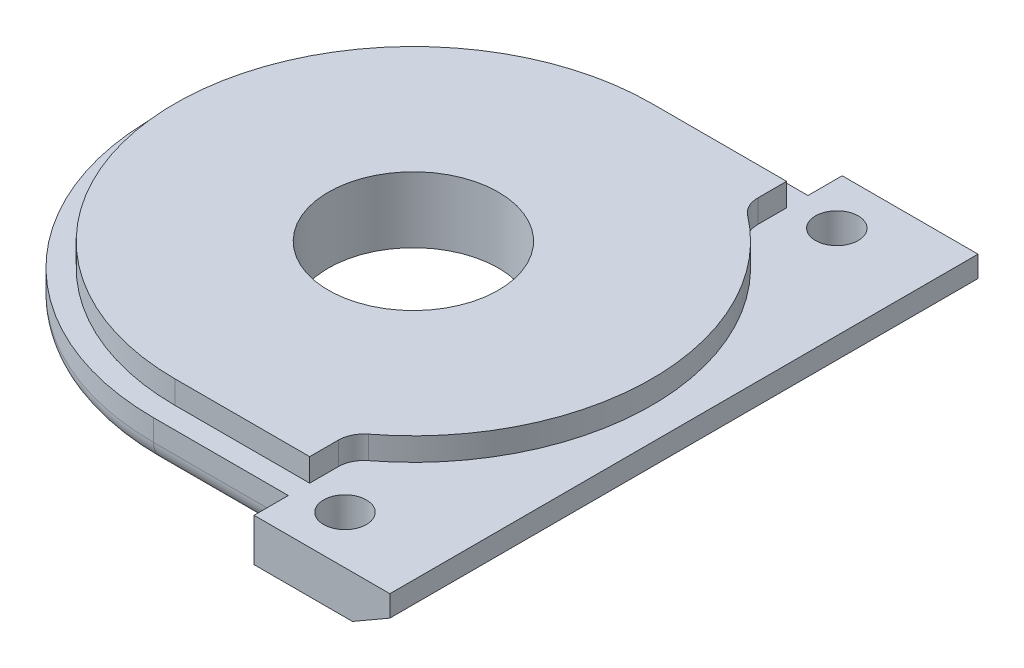
from build123d import *

# Parameters (mm, degrees)
BOSS_EXTRUDE1_DEPTH = 4
BOSS_EXTRUDE2_DEPTH = 2.25
SKETCH3_R           = 7.95
CUT_EXTRUDE1_DEPTH  = 9.25
SKETCH4_R           = 2
CUT_EXTRUDE2_DEPTH  = 9.25
CUT_EXTRUDE3_DEPTH  = 3
FILLET1_R           = 2.36
CHAMFER1_SIZE       = 3.5
CHAMFER1_SIZE2      = 2.020725942
BOSS_EXTRUDE3_DEPTH = 4
FILLET2_R           = 2
SKETCH7_W           = 56.562445917
SKETCH7_H           = 51.963873078
CUT_EXTRUDE4_DEPTH  = 0.1
FILLET3_R           = 2.38


with BuildPart() as part:
    # Sketch1 → Boss-Extrude1 (new body)
    with BuildSketch(Plane(origin=(0, 0, 0), x_dir=(1, 0, 0), z_dir=(0, 1, 0))):
        with BuildLine():
            Line((-13.29118379, 20.889836125), (-0.68999579, 20.889836125))
            Line((-0.68999579, 20.889836125), (-0.68999579, 24.09210312))
            Line((-0.68999579, 24.09210312), (-0.68999579, 26.09210312))
            Line((-0.68999579, 26.09210312), (12.01000421, 26.09210312))
            Line((12.01000421, 26.09210312), (12.01000421, 24.09210312))
            Line((12.01000421, 24.09210312), (12.01000421, -26.90789688))
            Line((12.01000421, -26.90789688), (12.01000421, -28.90789688))
            Line((12.01000421, -28.90789688), (-0.68999579, -28.90789688))
            Line((-0.68999579, -28.90789688), (-0.68999579, -26.90789688))
            Line((-0.68999579, -26.90789688), (-0.68999579, -23.705629885))
            Line((-0.68999579, -23.705629885), (-13.29118379, -23.705629885))
            ThreePointArc((-13.29118379, -23.705629885), (-35.588916795, -1.40789688), (-13.29118379, 20.889836125))
        make_face()
    extrude(amount=BOSS_EXTRUDE1_DEPTH)

    # Sketch2 → Boss-Extrude2 (add)
    with BuildSketch(Plane(origin=(0, 4, 0), x_dir=(1, 0, 0), z_dir=(0, 1, 0))):
        with BuildLine():
            Line((-0.68999579, 20.889836125), (-0.68999579, 16.987726462))
            ThreePointArc((-0.68999579, 16.987726462), (9.006549215, -1.40789688), (-0.68999579, -19.803520222))
            Line((-0.68999579, -19.803520222), (-0.68999579, -23.705629885))
            Line((-0.68999579, -23.705629885), (-13.29118379, -23.705629885))
            ThreePointArc((-13.29118379, -23.705629885), (-35.588916795, -1.40789688), (-13.29118379, 20.889836125))
            Line((-13.29118379, 20.889836125), (-0.68999579, 20.889836125))
        make_face()
    extrude(amount=BOSS_EXTRUDE2_DEPTH)

    # Sketch3 → Cut-Extrude1 (cut)
    with BuildSketch(Plane.XZ):
        with Locations((-13.29118379, 1.40789688)):
            Circle(SKETCH3_R)
    extrude(amount=-CUT_EXTRUDE1_DEPTH, mode=Mode.SUBTRACT)

    # Sketch4 → Cut-Extrude2 (cut)
    with BuildSketch(Plane.XZ):
        with Locations((3.31000421, -21.59210312)):
            Circle(SKETCH4_R)
        with Locations((3.31000421, 24.40789688)):
            Circle(SKETCH4_R)
    extrude(amount=-CUT_EXTRUDE2_DEPTH, mode=Mode.SUBTRACT)

    # Sketch5 → Cut-Extrude3 (cut)
    with BuildSketch(Plane.XZ):
        with BuildLine():
            ThreePointArc((-20.917233099, -7.792422241), (-25.24118379, 1.40789688), (-20.917233099, 10.608216001))
            Line((-20.917233099, 10.608216001), (-24.193916765, 16.291878661))
            ThreePointArc((-24.193916765, 16.291878661), (-31.74118379, 1.40789688), (-24.193916765, -13.476084902))
            Line((-24.193916765, -13.476084902), (-20.917233099, -7.792422241))
        make_face()
        with BuildLine():
            Line((-20.729723635, 18.291931497), (-17.445869217, 12.612408873))
            ThreePointArc((-17.445869217, 12.612408873), (-7.31618379, 11.756900455), (-1.510449053, 3.412089752))
            Line((-1.510449053, 3.412089752), (5.05008903, 3.407949716))
            ThreePointArc((5.05008903, 3.407949716), (-4.06618379, 17.38606558), (-20.729723635, 18.291931497))
        make_face()
        with BuildLine():
            ThreePointArc((-1.510449053, -0.596295992), (-7.31618379, -8.941106696), (-17.445869217, -9.796615113))
            Line((-17.445869217, -9.796615113), (-20.729723635, -15.476137738))
            ThreePointArc((-20.729723635, -15.476137738), (-4.06618379, -14.57027182), (5.05008903, -0.592155956))
            Line((5.05008903, -0.592155956), (-1.510449053, -0.596295992))
        make_face()
    extrude(amount=-CUT_EXTRUDE3_DEPTH, mode=Mode.SUBTRACT)

    # Fillet1
    fillet1_edges = [part.edges().sort_by_distance(p)[0] for p in [
        (5.05008903, 1.5, 3.407949716),
        (-1.510449053, 1.5, 3.412089752),
        (5.05008903, 1.5, -0.592155956),
        (-24.193916765, 1.5, 16.291878661),
        (-20.729723635, 1.5, 18.291931497),
        (-1.510449053, 1.5, -0.596295992),
        (-20.729723635, 1.5, -15.476137738),
        (-20.917233099, 1.5, 10.608216001),
        (-20.917233099, 1.5, -7.792422241),
        (-24.193916765, 1.5, -13.476084902),
        (-17.445869217, 1.5, -9.796615113),
        (-17.445869217, 1.5, 12.612408873),
    ]]
    fillet(fillet1_edges, radius=FILLET1_R)

    # Chamfer1
    chamfer1_edges = [part.edges().sort_by_distance(p)[0] for p in [
        (12.01000421, 0, 1.40789688),
    ]]
    chamfer1_side = [part.faces().sort_by_distance(p)[0] for p in [
        (-3.702499267, 0, 18.015985651),
    ]]
    chamfer(chamfer1_edges, length=CHAMFER1_SIZE, length2=CHAMFER1_SIZE2, reference=chamfer1_side[0])

    # Sketch6 → Boss-Extrude3 (add)
    with BuildSketch(Plane.XZ):
        with BuildLine():
            Line((-0.68999579, -22.889836125), (-13.29118379, -22.889836125))
            ThreePointArc((-13.29118379, -22.889836125), (-37.588916795, 1.40789688), (-13.29118379, 25.705629885))
            Line((-13.29118379, 25.705629885), (-0.68999579, 25.705629885))
            Line((-0.68999579, 25.705629885), (-0.68999579, 23.705629885))
            Line((-0.68999579, 23.705629885), (-13.29118379, 23.705629885))
            ThreePointArc((-13.29118379, 23.705629885), (-35.588916795, 1.40789688), (-13.29118379, -20.889836125))
            Line((-13.29118379, -20.889836125), (-0.68999579, -20.889836125))
            Line((-0.68999579, -20.889836125), (-0.68999579, -22.889836125))
        make_face()
    extrude(amount=-BOSS_EXTRUDE3_DEPTH)

    # Fillet2
    fillet2_edges = [part.edges().sort_by_distance(p)[0] for p in [
        (-6.99058979, 0, 25.705629885),
        (-6.99058979, 0, -22.889836125),
        (-37.588916795, 0, 1.40789688),
    ]]
    fillet(fillet2_edges, radius=FILLET2_R)

    # Sketch7 → Cut-Extrude4 (cut)
    with BuildSketch(Plane(origin=(0, 6.25, 0), x_dir=(1, 0, 0), z_dir=(0, 1, 0))):
        with Locations((-12.789456293, -2.500057929)):
            Rectangle(SKETCH7_W, SKETCH7_H)
    extrude(amount=-CUT_EXTRUDE4_DEPTH, mode=Mode.SUBTRACT)

    # Fillet3
    fillet3_edges = [part.edges().sort_by_distance(p)[0] for p in [
        (-0.68999579, 5.075, -16.987726462),
        (-0.68999579, 5.075, 19.803520222),
    ]]
    fillet(fillet3_edges, radius=FILLET3_R)


solid = part.part
